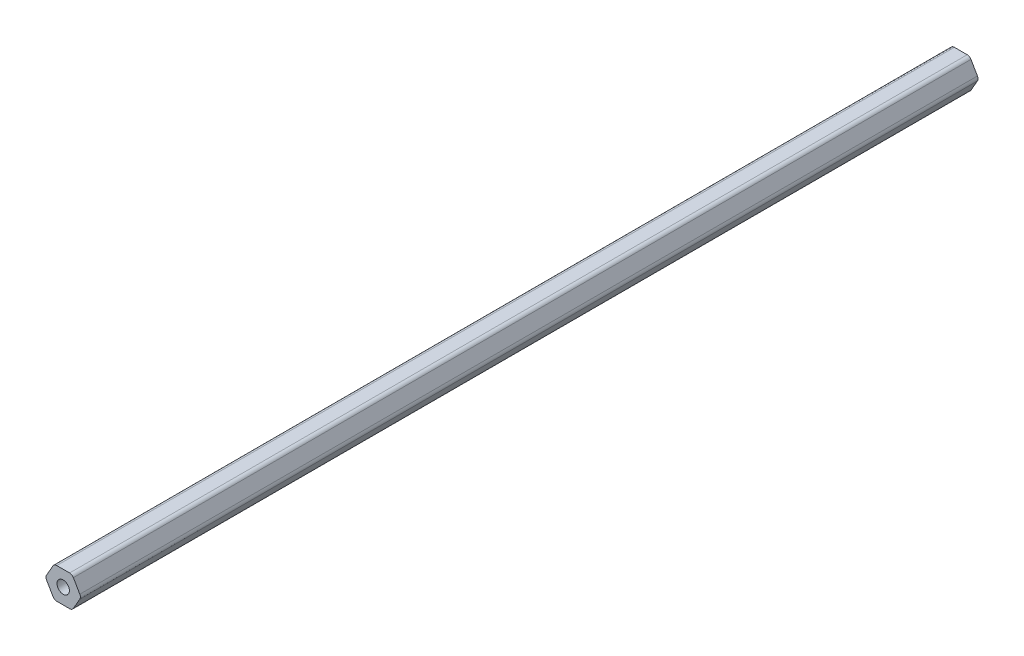
from build123d import *

# Parameters (mm, degrees)
SKETCH1_R           = 2.54
BOSS_EXTRUDE1_DEPTH = 368.3
FILLET1_R           = 1.778


with BuildPart() as part:
    # Sketch1 → Boss-Extrude1 (new body)
    with BuildSketch(Plane.XY):
        Polygon((5.605016339, 0.370142588), (1.93884213, 6.720142588), (-5.393506289, 6.720142588), (-9.059680498, 0.370142588), (-5.393506289, -5.979857412), (1.93884213, -5.979857412), align=None)
        with Locations((-1.727332079, 0.370142588)):
            Circle(SKETCH1_R, mode=Mode.SUBTRACT)
    extrude(amount=BOSS_EXTRUDE1_DEPTH)

    # Fillet1
    fillet1_edges = [part.edges().sort_by_distance(p)[0] for p in [
        (1.93884213, -5.979857412, 184.15),
        (-5.393506289, -5.979857412, 184.15),
        (-9.059680498, 0.370142588, 184.15),
        (-5.393506289, 6.720142588, 184.15),
        (1.93884213, 6.720142588, 184.15),
        (5.605016339, 0.370142588, 184.15),
    ]]
    fillet(fillet1_edges, radius=FILLET1_R)


solid = part.part
